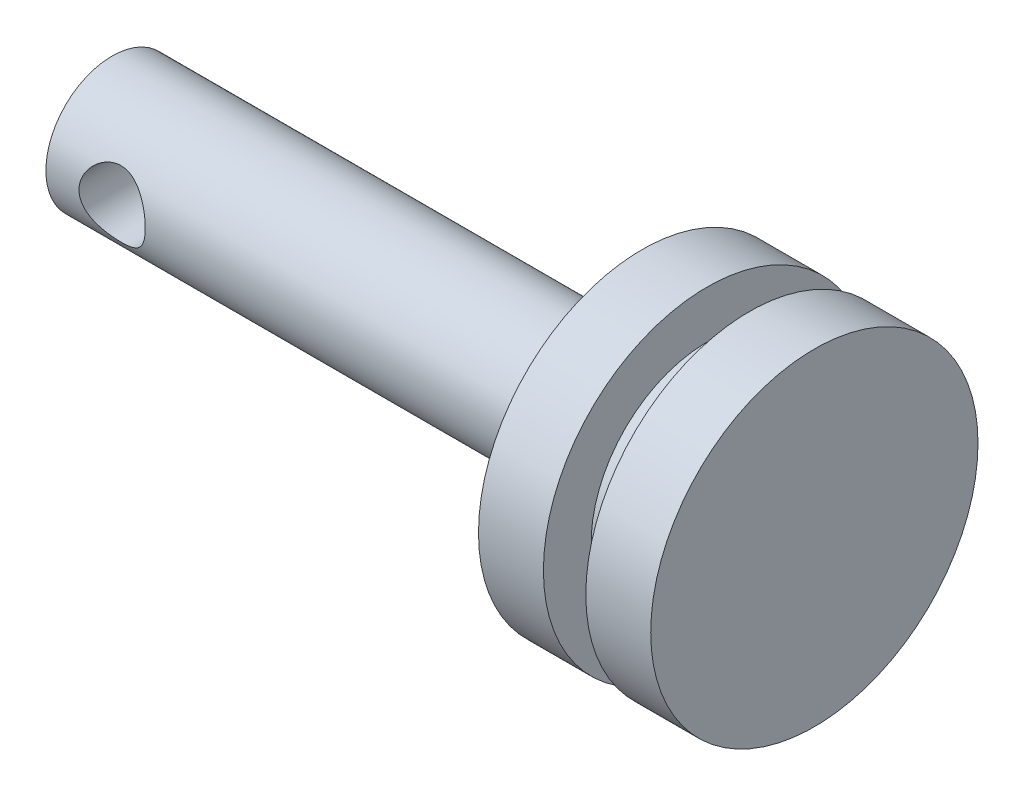
from build123d import *

# Parameters (mm, degrees)
CUT_EXTRUDE1_DEPTH      = 10
CUT_EXTRUDE1_DEPTH_BACK = 10
SKETCH2_R               = 2.5


with BuildPart() as part:
    # Sketch1 → Revolve1 (revolve)
    with BuildSketch(Plane.XY, mode=Mode.PRIVATE) as revolve1_sk:
        Polygon((0, 0), (0, 5), (40, 5), (40, 12.35), (44.9, 12.35), (44.9, 8.75), (48.1, 8.75), (48.1, 12.35), (53, 12.35), (53, 0), align=None)
    revolve(revolve1_sk.sketch.rotate(Axis((53, 0, 0), (-1, 0, 0)), 90), axis=Axis((53, 0, 0), (-1, 0, 0)))

    # Sketch2 → Cut-Extrude1 (cut, two sides: drawn at the far end of the back side and taken through both)
    with BuildSketch(Plane.XY.offset(-CUT_EXTRUDE1_DEPTH_BACK)):
        with Locations(Location((5, 0, 0), (0, 0, 180))):
            Circle(SKETCH2_R)
    extrude(amount=CUT_EXTRUDE1_DEPTH + CUT_EXTRUDE1_DEPTH_BACK, mode=Mode.SUBTRACT)


solid = part.part
